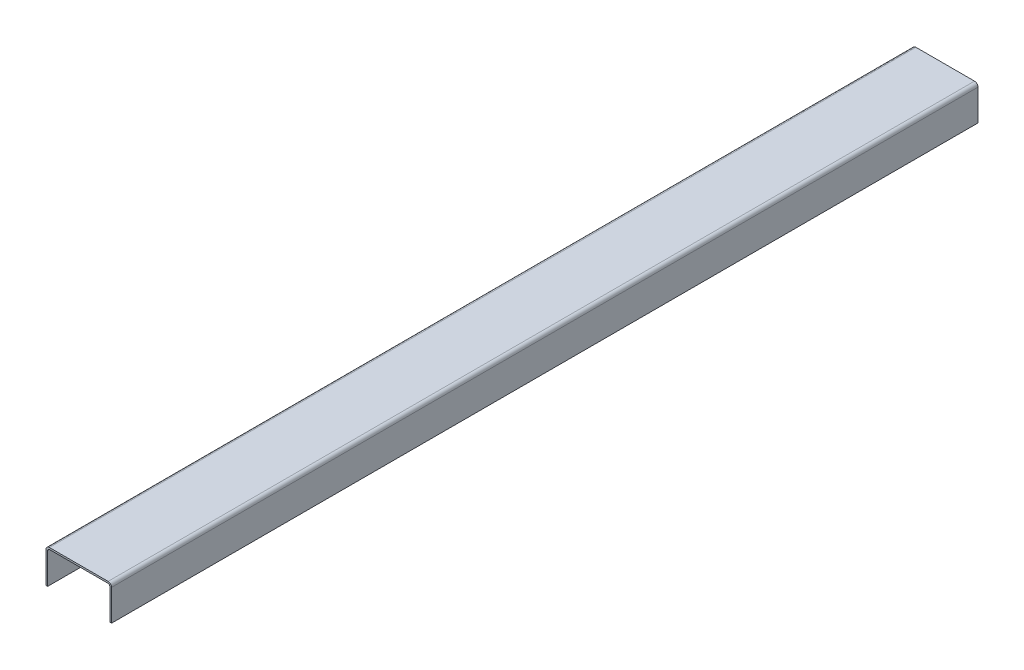
from build123d import *

# Parameters (mm, degrees)
BOSS_EXTRUDE1_DEPTH = 502.33


with BuildPart() as part:
    # Sketch1 → Boss-Extrude1 (new body)
    with BuildSketch(Plane.XY):
        with BuildLine():
            Line((0, 0), (0, 18))
            ThreePointArc((0, 18), (0.585786438, 19.414213562), (2, 20))
            Line((2, 20), (36, 20))
            ThreePointArc((36, 20), (37.414213562, 19.414213562), (38, 18))
            Line((38, 18), (38, 0))
            Line((38, 0), (37, 0))
            Line((37, 0), (37, 18))
            ThreePointArc((37, 18), (36.707106781, 18.707106781), (36, 19))
            Line((36, 19), (2, 19))
            ThreePointArc((2, 19), (1.292893219, 18.707106781), (1, 18))
            Line((1, 18), (1, 0))
            Line((1, 0), (0, 0))
        make_face()
    extrude(amount=BOSS_EXTRUDE1_DEPTH)


solid = part.part
